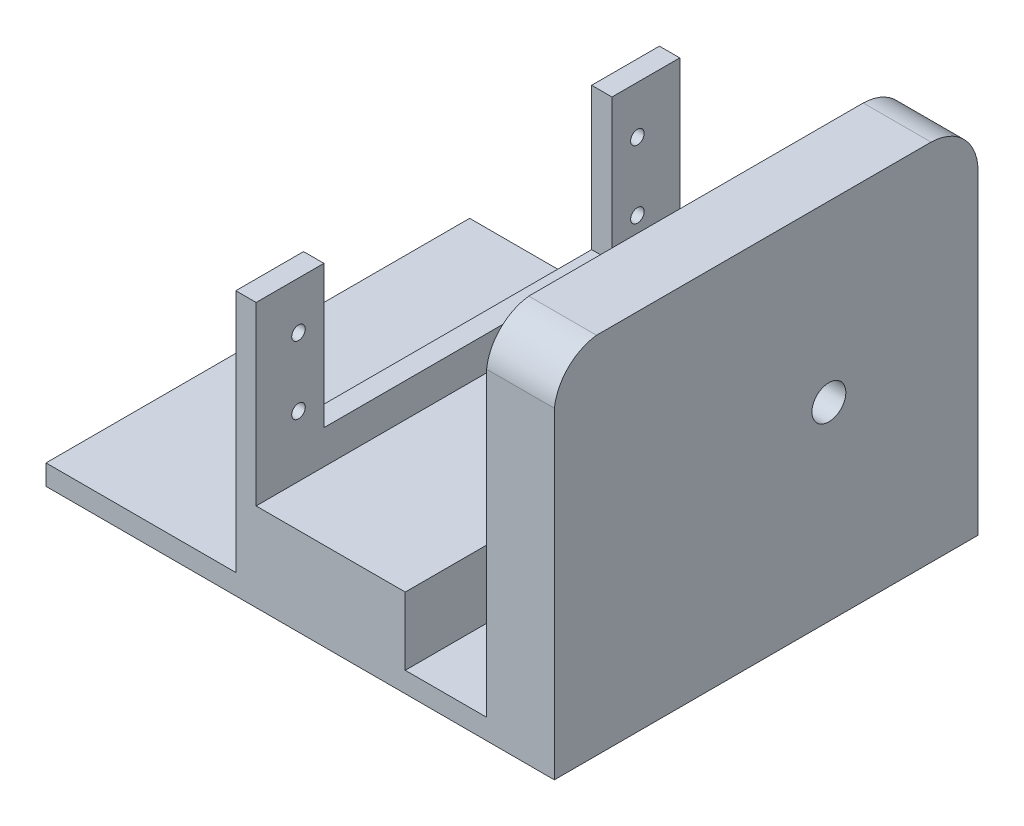
from build123d import *

# Parameters (mm, degrees)
SKETCH1_W           = 99
SKETCH1_H           = 62.5
BOSS_EXTRUDE1_DEPTH = 53.7
SKETCH2_W           = 79
SKETCH2_H           = 62.5
CUT_EXTRUDE1_DEPTH  = 50.7
SKETCH3_W           = 25
SKETCH3_H           = 62.5
BOSS_EXTRUDE2_DEPTH = 10
BOSS_EXTRUDE4_DEPTH = 3
SKETCH5_W           = 24
SKETCH5_H           = 62.5
CUT_EXTRUDE3_DEPTH  = 72
CUT_EXTRUDE4_REACH  = 96.863
SKETCH6_R           = 1
SKETCH7_R           = 2.5
CUT_EXTRUDE5_DEPTH  = 72
CUT_EXTRUDE7_DEPTH  = 50


with BuildPart() as part:
    # Sketch1 → Boss-Extrude1 (new body)
    with BuildSketch(Plane(origin=(0, 0, 0), x_dir=(1, 0, 0), z_dir=(0, 1, 0))):
        with Locations((49.5, 31.25)):
            Rectangle(SKETCH1_W, SKETCH1_H)
    extrude(amount=BOSS_EXTRUDE1_DEPTH)

    # Sketch2 → Cut-Extrude1 (cut)
    with BuildSketch(Plane(origin=(0, 53.7, 0), x_dir=(1, 0, 0), z_dir=(0, 1, 0))):
        with Locations((49.5, 31.25)):
            Rectangle(SKETCH2_W, SKETCH2_H)
    extrude(amount=-CUT_EXTRUDE1_DEPTH, mode=Mode.SUBTRACT)

    # Sketch3 → Boss-Extrude2 (add)
    with BuildSketch(Plane(origin=(0, 3, 0), x_dir=(1, 0, 0), z_dir=(0, 1, 0))):
        with Locations((64.5, 31.25)):
            Rectangle(SKETCH3_W, SKETCH3_H)
    extrude(amount=BOSS_EXTRUDE2_DEPTH)

    # Sketch4 → Boss-Extrude4 (add)
    with BuildSketch(Plane.ZY.offset(-52)):
        Polygon((-62.5, 13), (-62.5, 39), (-52.5, 39), (-52.5, 18), (-10, 18), (-10, 39), (0, 39), (0, 13), align=None)
    extrude(amount=-BOSS_EXTRUDE4_DEPTH)

    # Sketch5 → Cut-Extrude3 (cut)
    with BuildSketch(Plane.XZ):
        with Locations((12, -31.25)):
            Rectangle(SKETCH5_W, SKETCH5_H)
    extrude(amount=-CUT_EXTRUDE3_DEPTH, mode=Mode.SUBTRACT)

    # Sketch6 → Cut-Extrude4 (cut, up to next)
    with BuildSketch(Plane.ZY.offset(-52), mode=Mode.PRIVATE) as cut_extrude4_sk1:
        with Locations((-56.25, 32)):
            Circle(SKETCH6_R)
    cut_extrude4_tool1 = extrude(cut_extrude4_sk1.sketch, amount=-CUT_EXTRUDE4_REACH, mode=Mode.PRIVATE) & part.part
    # Sketch6 → Cut-Extrude4 (cut, up to next)
    with BuildSketch(Plane.ZY.offset(-52), mode=Mode.PRIVATE) as cut_extrude4_sk2:
        with Locations((-56.25, 22)):
            Circle(SKETCH6_R)
    cut_extrude4_tool2 = extrude(cut_extrude4_sk2.sketch, amount=-CUT_EXTRUDE4_REACH, mode=Mode.PRIVATE) & part.part
    # Sketch6 → Cut-Extrude4 (cut, up to next)
    with BuildSketch(Plane.ZY.offset(-52), mode=Mode.PRIVATE) as cut_extrude4_sk3:
        with Locations((-6.25, 22)):
            Circle(SKETCH6_R)
    cut_extrude4_tool3 = extrude(cut_extrude4_sk3.sketch, amount=-CUT_EXTRUDE4_REACH, mode=Mode.PRIVATE) & part.part
    # Sketch6 → Cut-Extrude4 (cut, up to next)
    with BuildSketch(Plane.ZY.offset(-52), mode=Mode.PRIVATE) as cut_extrude4_sk4:
        with Locations((-6.25, 32)):
            Circle(SKETCH6_R)
    cut_extrude4_tool4 = extrude(cut_extrude4_sk4.sketch, amount=-CUT_EXTRUDE4_REACH, mode=Mode.PRIVATE) & part.part
    add(cut_extrude4_tool1.solids().sort_by_distance((52, 32, -56.25))[0], mode=Mode.SUBTRACT)
    add(cut_extrude4_tool2.solids().sort_by_distance((52, 22, -56.25))[0], mode=Mode.SUBTRACT)
    add(cut_extrude4_tool3.solids().sort_by_distance((52, 22, -6.25))[0], mode=Mode.SUBTRACT)
    add(cut_extrude4_tool4.solids().sort_by_distance((52, 32, -6.25))[0], mode=Mode.SUBTRACT)

    # Sketch7 → Cut-Extrude5 (cut)
    with BuildSketch(Plane(origin=(99, 0, 0), x_dir=(0, 0, -1), z_dir=(1, 0, 0))):
        with Locations((40.5, 28)):
            Circle(SKETCH7_R)
    extrude(amount=-CUT_EXTRUDE5_DEPTH, mode=Mode.SUBTRACT)

    # Sketch10 → Cut-Extrude7 (cut)
    with BuildSketch(Plane(origin=(99, 0, 0), x_dir=(0, 0, -1), z_dir=(1, 0, 0))):
        with BuildLine():
            Line((0, 53.7), (0, 47.481187229))
            ThreePointArc((0, 47.481187229), (2.036166959, 51.663833041), (6.218812771, 53.7))
            Line((6.218812771, 53.7), (0, 53.7))
        make_face()
        with BuildLine():
            ThreePointArc((62.5, 46.622902441), (60.478284246, 51.575372551), (55.569083395, 53.7))
            Line((55.569083395, 53.7), (62.5, 53.7))
            Line((62.5, 53.7), (62.5, 46.622902441))
        make_face()
    extrude(amount=-CUT_EXTRUDE7_DEPTH, mode=Mode.SUBTRACT)


solid = part.part
